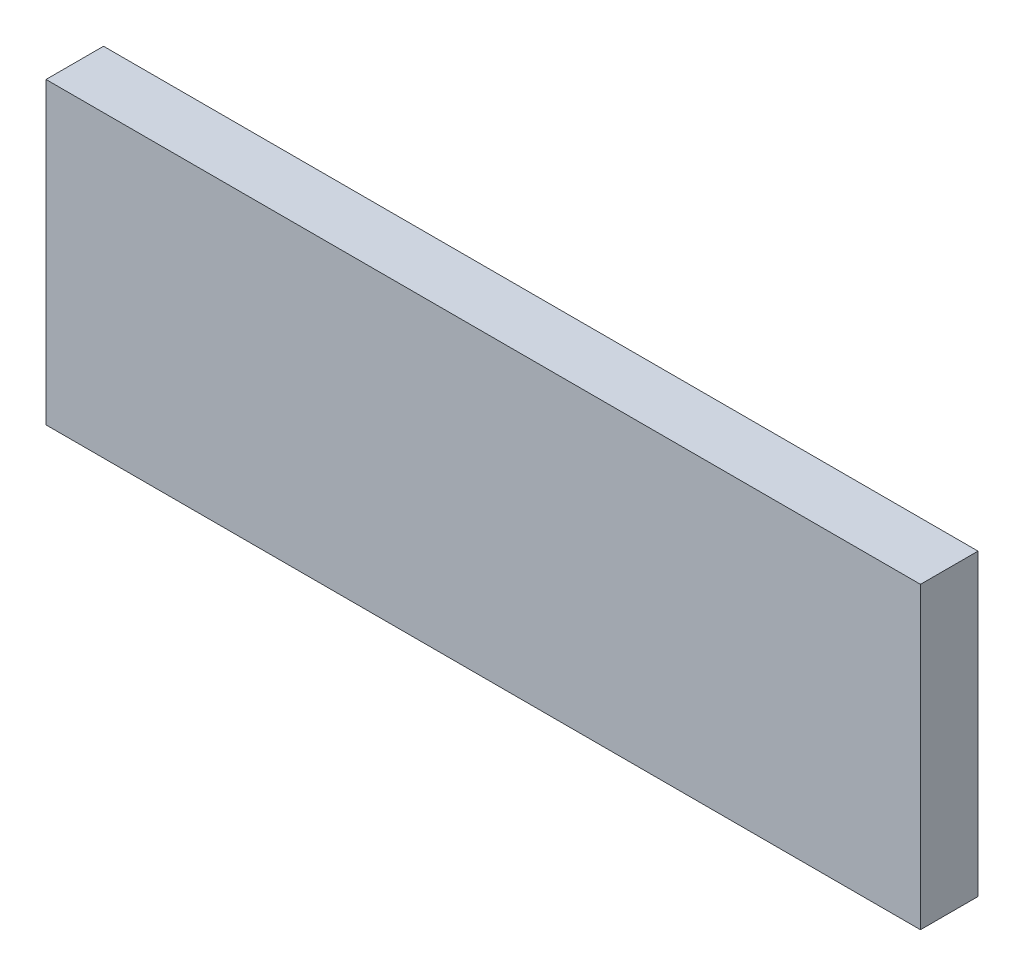
from build123d import *

# Parameters (mm, degrees)
ESQUISSE1_W        = 304
ESQUISSE1_H        = 104
BOSS_EXTRU_1_DEPTH = 20


with BuildPart() as part:
    # Esquisse1 → Boss.-Extru.1 (new body)
    with BuildSketch(Plane.XY):
        Rectangle(ESQUISSE1_W, ESQUISSE1_H)
    extrude(amount=BOSS_EXTRU_1_DEPTH)


solid = part.part
